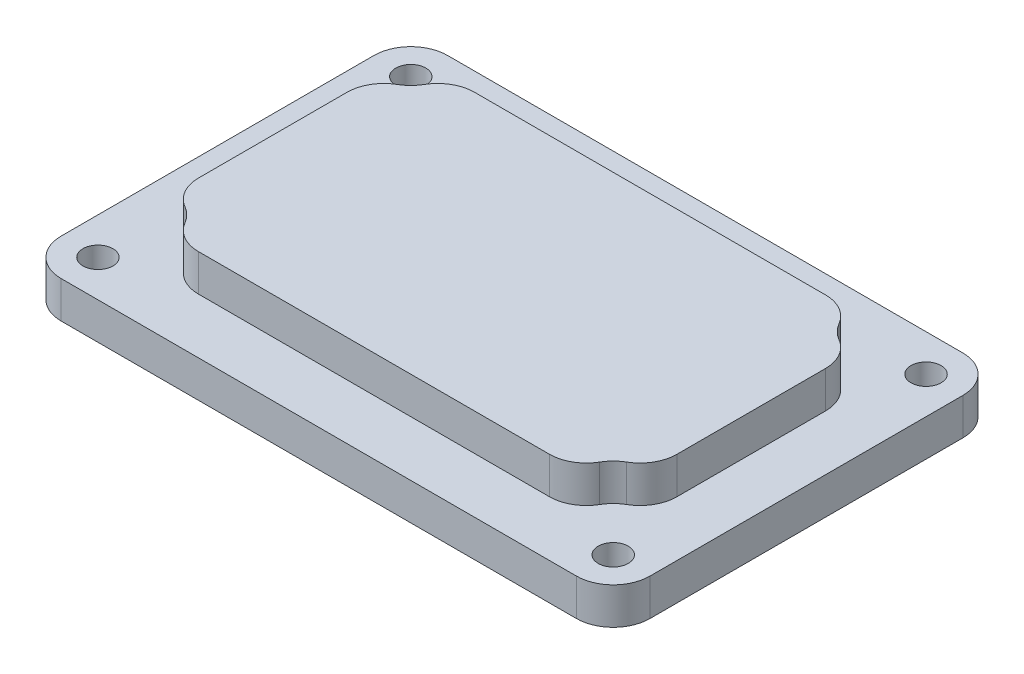
from build123d import *

# Parameters (mm, degrees)
BASE_EXTRUDE_DEPTH        = 6.35
SKETCH2_W                 = 82.55
SKETCH2_H                 = 47.625
TOP_BOSS_DEPTH            = 6.35
SKETCH3_R                 = 6.35
BASE_CUT_DEPTH            = 6.35
FILLET_2_R                = 6.35
SHELL_T                   = -3.175
CORNER_START              = 3.175
SKETCH4_R                 = 6.35
CORNER_EXTRUDE_DEPTH      = 3.175
SHELL_FILLET_R            = 0.7874
F_6_0_204_DIAMETER_HOLE_D = 5.1816


with BuildPart() as part:
    # Sketch1 → Base Extrude (new body)
    with BuildSketch(Plane(origin=(0, 0, 0), x_dir=(1, 0, 0), z_dir=(0, 1, 0))):
        with BuildLine():
            Line((44.45, -33.3375), (-44.45, -33.3375))
            ThreePointArc((-44.45, -33.3375), (-48.940128061, -31.477628061), (-50.8, -26.9875))
            Line((-50.8, -26.9875), (-50.8, 26.9875))
            ThreePointArc((-50.8, 26.9875), (-48.940128061, 31.477628061), (-44.45, 33.3375))
            Line((-44.45, 33.3375), (44.45, 33.3375))
            ThreePointArc((44.45, 33.3375), (48.940128061, 31.477628061), (50.8, 26.9875))
            Line((50.8, 26.9875), (50.8, -26.9875))
            ThreePointArc((50.8, -26.9875), (48.940128061, -31.477628061), (44.45, -33.3375))
        make_face()
    extrude(amount=BASE_EXTRUDE_DEPTH)

    # Sketch2 → Top Boss (add)
    with BuildSketch(Plane(origin=(0, 6.35, 0), x_dir=(1, 0, 0), z_dir=(0, 1, 0))):
        Rectangle(SKETCH2_W, SKETCH2_H)
    extrude(amount=TOP_BOSS_DEPTH)

    # Sketch3 → Base Cut (cut)
    with BuildSketch(Plane(origin=(0, 12.7, 0), x_dir=(1, 0, 0), z_dir=(0, 1, 0))):
        with Locations((41.275, 23.8125)):
            Circle(SKETCH3_R)
        with Locations((-41.275, 23.8125)):
            Circle(SKETCH3_R)
        with Locations((41.275, -23.8125)):
            Circle(SKETCH3_R)
        with Locations((-41.275, -23.8125)):
            Circle(SKETCH3_R)
    extrude(amount=-BASE_CUT_DEPTH, mode=Mode.SUBTRACT)

    # Fillet 2
    fillet_2_edges = [part.edges().sort_by_distance(p)[0] for p in [
        (-34.925, 9.525, -23.8125),
        (-41.275, 9.525, -17.4625),
        (41.275, 9.525, 17.4625),
        (34.925, 9.525, 23.8125),
        (-41.275, 9.525, 17.4625),
        (-34.925, 9.525, 23.8125),
        (41.275, 9.525, -17.4625),
        (34.925, 9.525, -23.8125),
    ]]
    fillet(fillet_2_edges, radius=FILLET_2_R)

    # Shell
    shell_openings = [part.faces().sort_by_distance(p)[0] for p in [
        (0, 0, 0),
    ]]
    offset(amount=SHELL_T, openings=shell_openings, kind=Kind.INTERSECTION)

    # Sketch4 → Corner Extrude (add)
    with BuildSketch(Plane(origin=(0, 3.175, 0), x_dir=(-1, 0, 0), z_dir=(0, -1, 0)).offset(CORNER_START)):
        with Locations((44.45, -26.9875)):
            Circle(SKETCH4_R)
        with Locations((-44.45, -26.9875)):
            Circle(SKETCH4_R)
        with Locations((-44.45, 26.9875)):
            Circle(SKETCH4_R)
        with Locations((44.45, 26.9875)):
            Circle(SKETCH4_R)
    extrude(amount=-CORNER_EXTRUDE_DEPTH)

    # Shell Fillet
    shell_fillet_edges = [part.edges().sort_by_distance(p)[0] for p in [
        (-37.674630657, 3.175, -14.401477372),
        (-31.863977372, 3.175, -20.212130657),
        (31.863977372, 3.175, -20.212130657),
        (37.674630657, 3.175, -14.401477372),
        (37.674630657, 3.175, 14.401477372),
        (31.863977372, 3.175, 20.212130657),
        (-31.863977372, 3.175, 20.212130657),
        (-37.674630657, 3.175, 14.401477372),
        (38.1, 3.175, 0),
        (0, 3.175, -20.6375),
        (-38.1, 3.175, 0),
        (0, 3.175, 20.6375),
        (-37.674630657, 9.525, -14.401477372),
        (-38.1, 9.525, 0),
        (-37.674630657, 9.525, 14.401477372),
        (-31.863977372, 9.525, 20.212130657),
        (0, 9.525, 20.6375),
        (31.863977372, 9.525, 20.212130657),
        (37.674630657, 9.525, 14.401477372),
        (38.1, 9.525, 0),
        (37.674630657, 9.525, -14.401477372),
        (31.863977372, 9.525, -20.212130657),
        (0, 9.525, -20.6375),
        (-31.863977372, 9.525, -20.212130657),
        (34.539807909, 9.525, -17.077307909),
        (34.539807909, 3.175, -17.077307909),
        (-34.539807909, 3.175, 17.077307909),
        (-34.539807909, 9.525, 17.077307909),
        (34.539807909, 3.175, 17.077307909),
        (34.539807909, 9.525, 17.077307909),
        (-34.539807909, 3.175, -17.077307909),
        (-34.539807909, 9.525, -17.077307909),
        (47.625, 3.175, 0),
        (39.959871939, 3.175, 22.497371939),
        (47.625, 0, 0),
        (47.625, 1.5875, 21.488238686),
        (38.950738686, 1.5875, 30.1625),
        (39.959871939, 0, 22.497371939),
        (0, 3.175, 30.1625),
        (-39.959871939, 3.175, 22.497371939),
        (0, 0, 30.1625),
        (-38.950738686, 1.5875, 30.1625),
        (-39.959871939, 0, 22.497371939),
        (-47.625, 1.5875, 21.488238686),
        (-47.625, 3.175, 0),
        (-39.959871939, 3.175, -22.497371939),
        (-47.625, 0, 0),
        (-47.625, 1.5875, -21.488238686),
        (-39.959871939, 0, -22.497371939),
        (-38.950738686, 1.5875, -30.1625),
        (0, 3.175, -30.1625),
        (39.959871939, 3.175, -22.497371939),
        (0, 0, -30.1625),
        (38.950738686, 1.5875, -30.1625),
        (47.625, 1.5875, -21.488238686),
        (39.959871939, 0, -22.497371939),
    ]]
    fillet(shell_fillet_edges, radius=SHELL_FILLET_R)

    # #6 (0.204) Diameter Hole (through all)
    with Locations(Plane(origin=(0, 6.35, 0), x_dir=(1, 0, 0), z_dir=(0, 1, 0))):
        with Locations((-44.45, 26.9875), (44.45, 26.9875), (44.45, -26.9875), (-44.45, -26.9875)):
            Hole(F_6_0_204_DIAMETER_HOLE_D / 2)


solid = part.part
